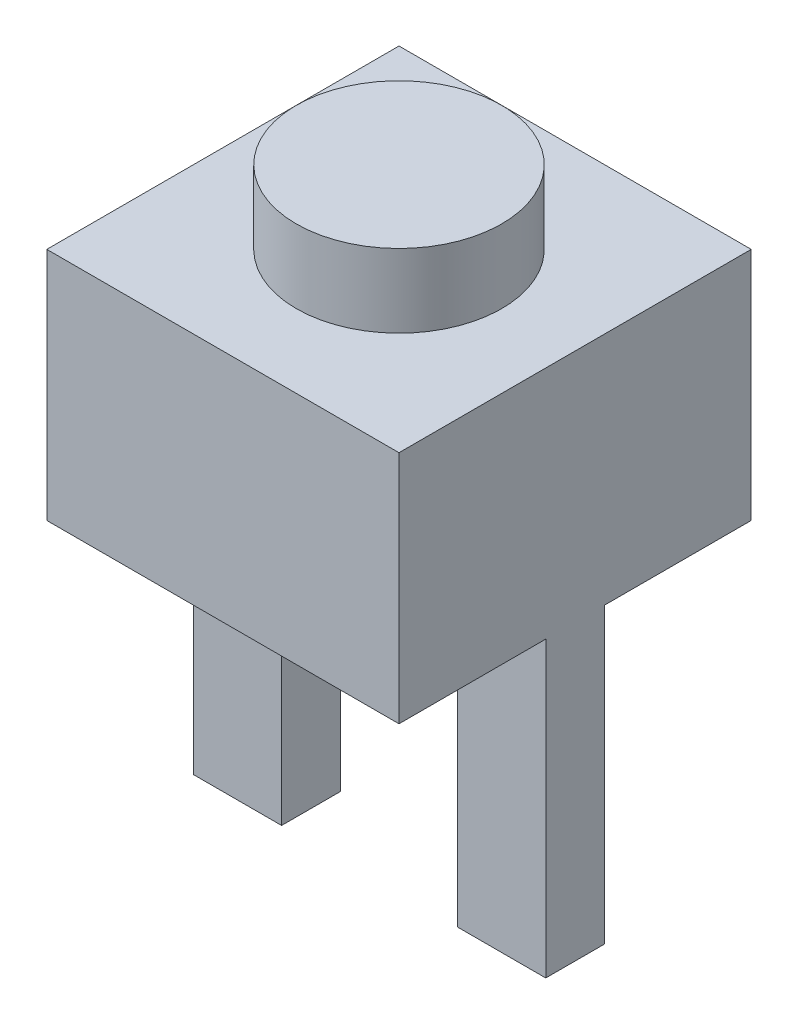
from build123d import *

# Parameters (mm, degrees)
SKETCH1_W           = 6
SKETCH1_H           = 6
BOSS_EXTRUDE1_DEPTH = 4
SKETCH2_R           = 1.75
BOSS_EXTRUDE2_DEPTH = 1.25
SKETCH3_W           = 1.5
SKETCH3_H           = 1
BOSS_EXTRUDE3_DEPTH = 5


with BuildPart() as part:
    # Sketch1 → Boss-Extrude1 (new body)
    with BuildSketch(Plane(origin=(0, 0, 0), x_dir=(1, 0, 0), z_dir=(0, 1, 0))):
        Rectangle(SKETCH1_W, SKETCH1_H)
    extrude(amount=BOSS_EXTRUDE1_DEPTH)

    # Sketch2 → Boss-Extrude2 (add)
    with BuildSketch(Plane(origin=(0, 4, 0), x_dir=(1, 0, 0), z_dir=(0, 1, 0))):
        with Locations(Location((0, 0, 0), (0, 0, 270))):
            Circle(SKETCH2_R)
    extrude(amount=BOSS_EXTRUDE2_DEPTH)

    # Sketch3 → Boss-Extrude3 (add)
    with BuildSketch(Plane.XZ):
        with Locations((2.25, 0)):
            Rectangle(SKETCH3_W, SKETCH3_H)
        with Locations((-2.25, 0)):
            Rectangle(SKETCH3_W, SKETCH3_H)
    extrude(amount=BOSS_EXTRUDE3_DEPTH)


solid = part.part
